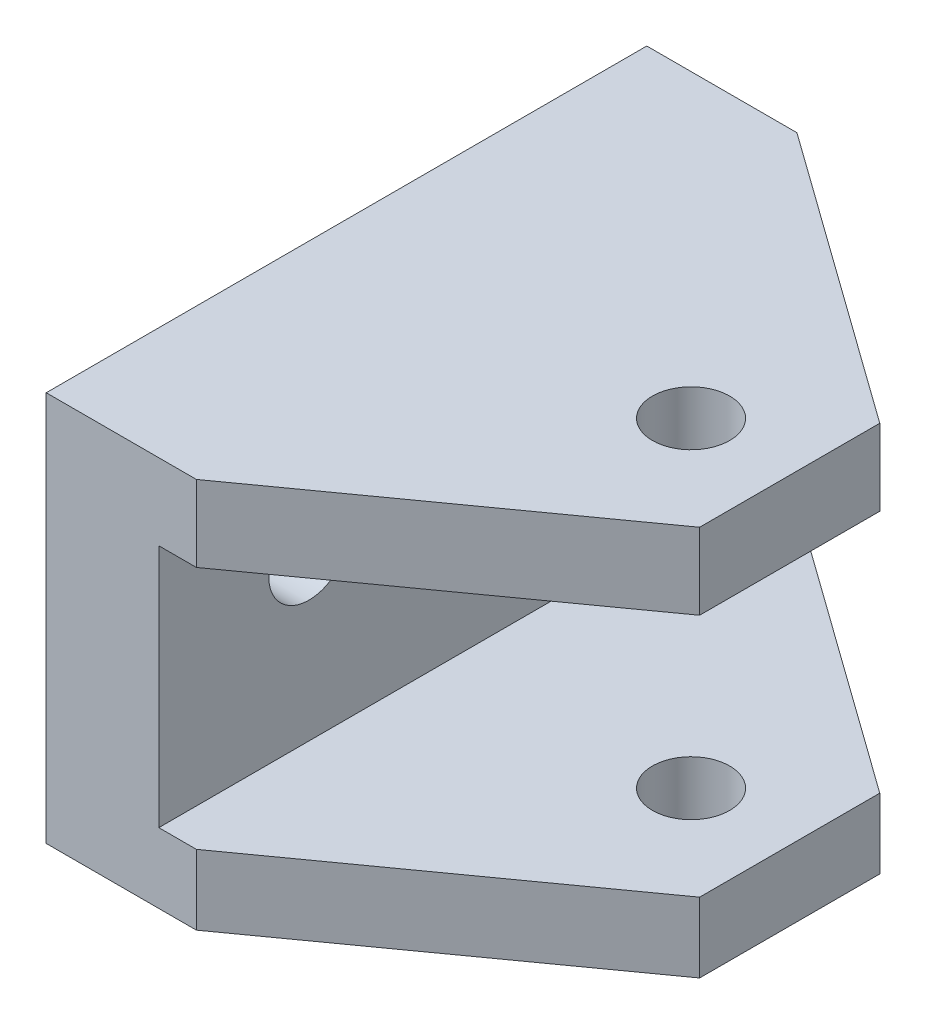
from build123d import *

# Parameters (mm, degrees)
BOSS_EXTRUDE1_DEPTH          = 50.8
SKETCH2_R                    = 3.4
M8X1_25_THREADED_HOLES_DEPTH = 50.8
CUT_EXTRUDE2_REACH           = 75.634
SKETCH3_R                    = 3.2639


with BuildPart() as part:
    # Sketch1 → Boss-Extrude1 (new body)
    with BuildSketch(Plane.XY):
        Polygon((0, 1.791647537), (0, 34.811647537), (41.845257966, 34.811647537), (41.845257966, 28.3636723), (9.525, 28.3636723), (9.525, 7.7134723), (41.845257966, 7.7134723), (41.845257966, 1.791647537), align=None)
    extrude(amount=BOSS_EXTRUDE1_DEPTH)

    # Sketch2 → M8x1.25 Threaded Holes (cut)
    with BuildSketch(Plane(origin=(9.525, 0, 0), x_dir=(0, 0, -1), z_dir=(1, 0, 0))):
        with Locations((-38.1, 21.430460881)):
            Circle(SKETCH2_R)
        with Locations((-12.7, 21.430460881)):
            Circle(SKETCH2_R)
    extrude(amount=-M8X1_25_THREADED_HOLES_DEPTH, mode=Mode.SUBTRACT)

    # Cut-Extrude2: up to this face of the body (flat: up to its plane)
    cut_extrude2_end = Plane(part.part.faces().sort_by_distance((20.922628983, 1.791647537, 25.4))[0])
    # Sketch3 → Cut-Extrude2 (cut, up to the picked face)
    with BuildSketch(Plane(origin=(0, 34.811647537, 0), x_dir=(1, 0, 0), z_dir=(0, 1, 0)), mode=Mode.PRIVATE) as cut_extrude2_sk1:
        with Locations(Location((29.145257966, -25.4, 0), (0, 0, 270))):
            Circle(SKETCH3_R)
    cut_extrude2_tool1 = split(extrude(cut_extrude2_sk1.sketch, amount=-CUT_EXTRUDE2_REACH, mode=Mode.PRIVATE), bisect_by=cut_extrude2_end, keep=Keep.BOTH, mode=Mode.PRIVATE)
    # Sketch3 → Cut-Extrude2 (cut, up to the picked face)
    with BuildSketch(Plane(origin=(0, 34.811647537, 0), x_dir=(1, 0, 0), z_dir=(0, 1, 0)), mode=Mode.PRIVATE) as cut_extrude2_sk2:
        Polygon((12.7, 0), (37.489157966, -17.78), (37.489157966, -33.02), (12.7, -50.8), (41.845257966, -50.8), (41.845257966, 0), align=None)
    cut_extrude2_tool2 = split(extrude(cut_extrude2_sk2.sketch, amount=-CUT_EXTRUDE2_REACH, mode=Mode.PRIVATE), bisect_by=cut_extrude2_end, keep=Keep.BOTH, mode=Mode.PRIVATE)
    add(cut_extrude2_tool1.solids().sort_by(Axis((29.145258, 34.811648, 25.4), (0, -1, 0)))[0], mode=Mode.SUBTRACT)
    add(cut_extrude2_tool2.solids().sort_by(Axis((25.435926, 34.811648, 8.414089), (0, -1, 0)))[0], mode=Mode.SUBTRACT)


solid = part.part
